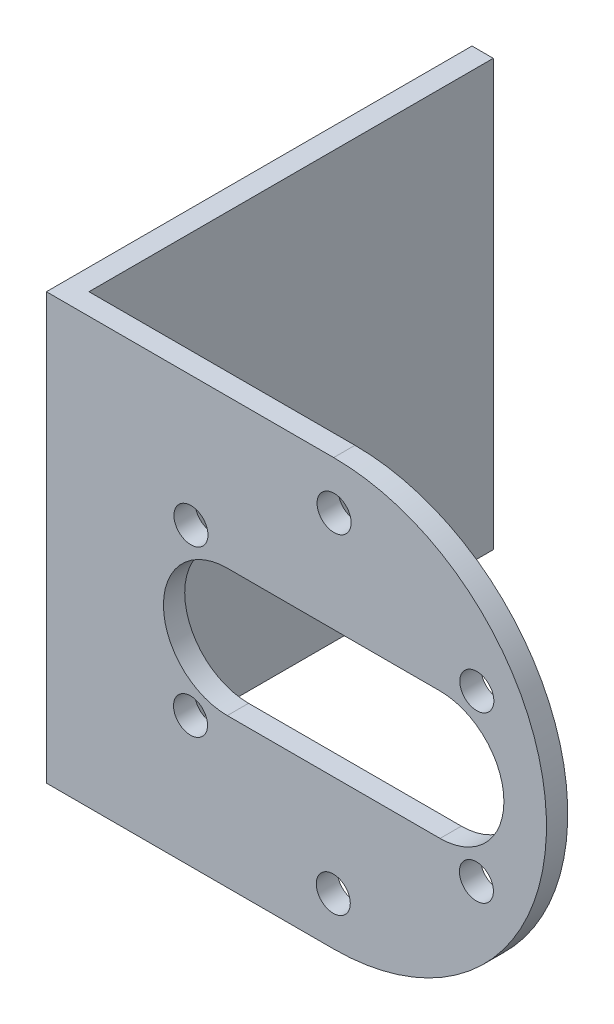
from build123d import *

# Parameters (mm, degrees)
SKETCH_1_W               = 40
SKETCH_1_H               = 40
EXTRUDE_1_DEPTH          = 2
EXTRUDE_2_DEPTH          = 2
CUT_EXTRUDE_1_DEPTH      = 2
PATTERN_CIRCULAR_1_COUNT = 6
CUT_EXTRUDE_2_DEPTH      = 65.876806437


with BuildPart() as part:
    # 草图1 → 凸台-拉伸1 (new body)
    with BuildSketch(Plane(origin=(0, 0, 0), x_dir=(0, 0, -1), z_dir=(1, 0, 0))):
        Rectangle(SKETCH_1_W, SKETCH_1_H)
    extrude(amount=EXTRUDE_1_DEPTH)

    # 草图3 → 凸台-拉伸2 (add)
    with BuildSketch(Plane.XY.offset(20)):
        with BuildLine():
            Line((0, 20), (27, 20))
            ThreePointArc((27, 20), (47, 0), (27, -20))
            Line((27, -20), (0, -20))
            Line((0, -20), (0, 20))
        make_face()
    extrude(amount=-EXTRUDE_2_DEPTH)

    # 草图3<4> → 切除-拉伸1 (cut)
    with BuildSketch(Plane.XY.offset(20)):
        with BuildLine():
            add(Edge.make_bspline(
                [(25.907322202, 14.381214063), (27.866913997, 12.421622269), (28.584174374, 15.09847444), (29.301434752, 17.775326612), (26.62458258, 17.058066235), (23.947730408, 16.340805857), (25.907322202, 14.381214063)],
                knots=[0, 0, 0, 2.094395102, 2.094395102, 4.188790205, 4.188790205, 6.283185307, 6.283185307, 6.283185307], degree=2, weights=[1, 0.5, 1, 0.5, 1, 0.5, 1]))
        make_face()
    cut_extrude_1 = extrude(amount=-CUT_EXTRUDE_1_DEPTH, mode=Mode.SUBTRACT)

    # 阵列(圆周)1: 切除-拉伸1 ×6 about axis
    pattern_circular_1_axis = Axis((27, 0, 20), (0, 0, 1))
    for i in range(1, PATTERN_CIRCULAR_1_COUNT):
        add(cut_extrude_1.rotate(pattern_circular_1_axis, i * 360 / PATTERN_CIRCULAR_1_COUNT), mode=Mode.SUBTRACT)

    # 草图3<5> → 切除-拉伸2 (cut, through all)
    with BuildSketch(Plane.XY.offset(20)):
        with BuildLine():
            Line((37, -6), (17, -6))
            ThreePointArc((17, -6), (11, 0), (17, 6))
            Line((17, 6), (37, 6))
            ThreePointArc((37, 6), (43, 0), (37, -6))
        make_face()
    extrude(amount=-CUT_EXTRUDE_2_DEPTH, mode=Mode.SUBTRACT)


solid = part.part
